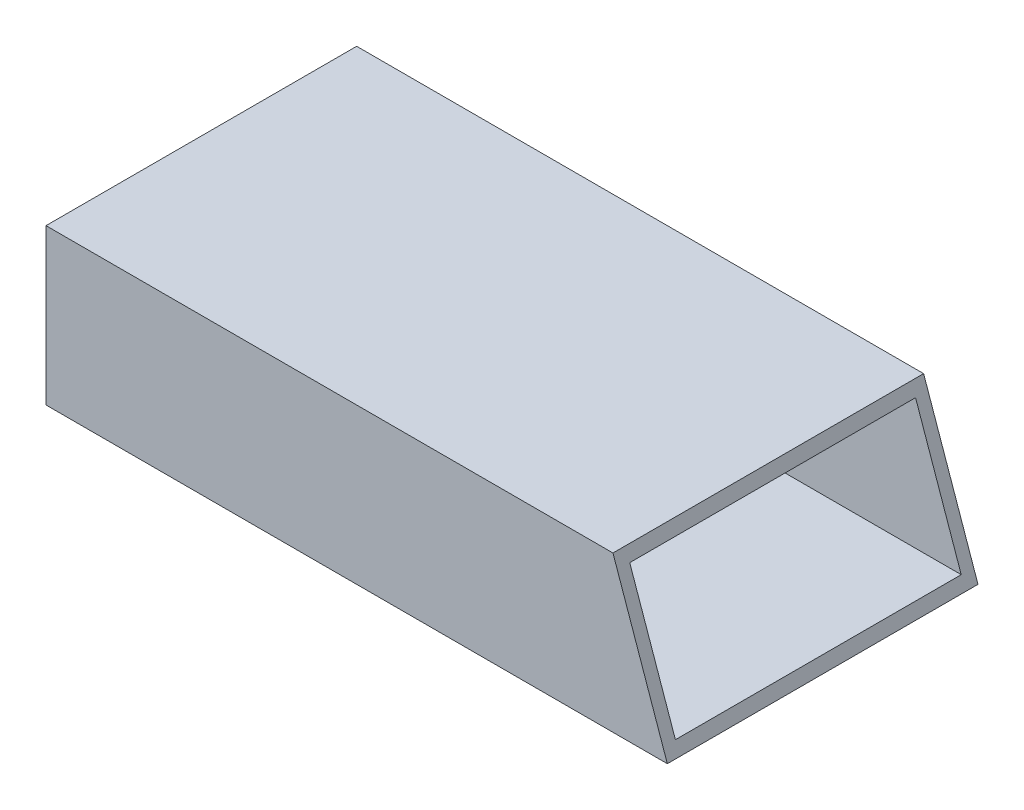
from build123d import *

# Parameters (mm, degrees)
DODANIE_WYCI_GNI_CIE1_DEPTH = 100
SZKIC2_W                    = 92
SZKIC2_H                    = 42
WYTNIJ_WYCI_GNI_CIE1_DEPTH  = 200


with BuildPart() as part:
    # Szkic1 → Dodanie-wyciągnięcie1 (new body)
    with BuildSketch(Plane.XY):
        Polygon((0, 0), (200, 0), (182.5, 50), (0, 50), align=None)
    extrude(amount=DODANIE_WYCI_GNI_CIE1_DEPTH)

    # Szkic2 → Wytnij-wyciągnięcie1 (cut)
    with BuildSketch(Plane.ZY):
        with Locations((50, 25)):
            Rectangle(SZKIC2_W, SZKIC2_H)
    extrude(amount=-WYTNIJ_WYCI_GNI_CIE1_DEPTH, mode=Mode.SUBTRACT)


solid = part.part
